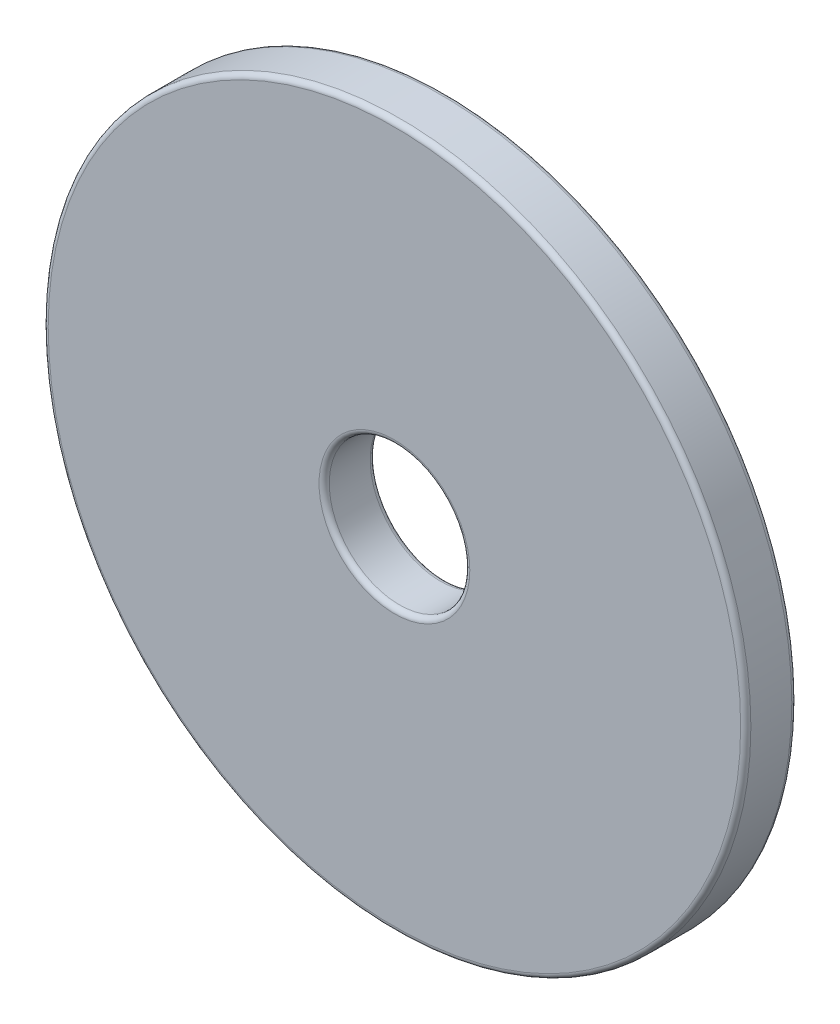
from build123d import *

# Parameters (mm, degrees)
BOSS_EXTRUDE1_START = 0.57785
SKETCH3_R           = 7.9375
SKETCH3_R_2         = 1.5875
BOSS_EXTRUDE1_DEPTH = 1.1557
FILLET1_R           = 0.11557


with BuildPart() as part:
    # Sketch3 → Boss-Extrude1 (new body)
    with BuildSketch(Plane.XY.offset(BOSS_EXTRUDE1_START)):
        Circle(SKETCH3_R)
        Circle(SKETCH3_R_2, mode=Mode.SUBTRACT)
    extrude(amount=-BOSS_EXTRUDE1_DEPTH)

    # Fillet1
    fillet1_edges = [part.edges().sort_by_distance(p)[0] for p in [
        (-7.9375, 0, 0.57785),
        (-7.9375, 0, -0.57785),
        (-1.5875, 0, -0.57785),
        (-1.5875, 0, 0.57785),
    ]]
    fillet(fillet1_edges, radius=FILLET1_R)


solid = part.part
